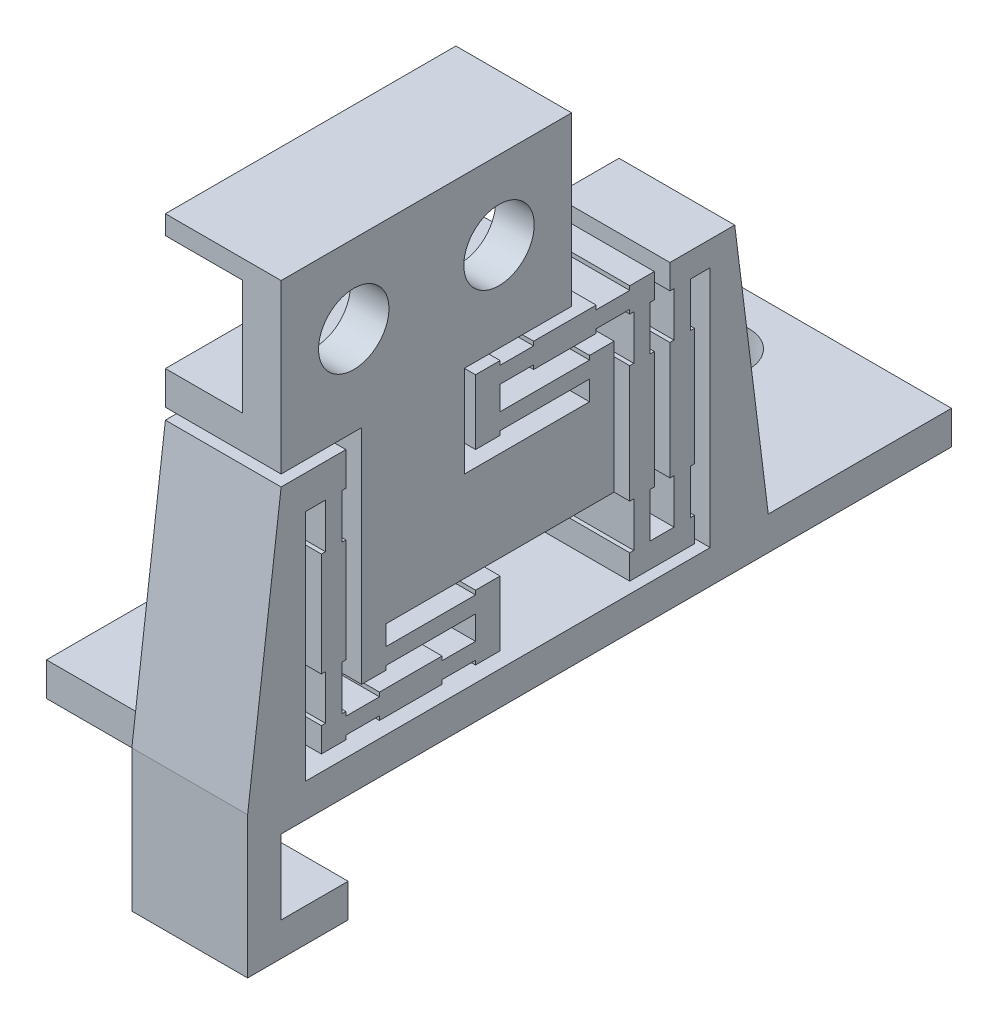
from build123d import *

# Parameters (mm, degrees)
BOSS_EXTRUDE1_DEPTH = 5.18
CUT_EXTRUDE1_REACH  = 36.536
SKETCH2_W           = 3.45
SKETCH2_H           = 5.15
SKETCH3_W           = 10.5
SKETCH3_H           = 30
SKETCH3_R           = 1.575
BOSS_EXTRUDE2_DEPTH = 1.5
CUT_EXTRUDE3_REACH  = 43.242
SKETCH7_R           = 1.575


with BuildPart() as part:
    # Sketch1 → Boss-Extrude1 (new body)
    with BuildSketch(Plane(origin=(0, 0, 0), x_dir=(0, 0, -1), z_dir=(1, 0, 0))):
        Polygon((0, 0), (13, 0), (13, -7.5), (8.2, -7.5), (8.2, -11.6), (13.8, -11.6), (13.8, -10.716666667), (9.8, -10.716666667), (9.8, -10.9), (8.7, -10.9), (8.7, -8), (9.8, -8), (9.8, -8.183333333), (11.3, -8.183333333), (11.3, -8), (14.1, -8), (14.1, -8.183333333), (15.6, -8.183333333), (15.6, -8), (16.7, -8), (16.7, -9.1), (16.516666667, -9.1), (16.516666667, -11.1), (16.7, -11.1), (16.7, -16.35), (16.516666667, -16.35), (16.516666667, -18.35), (17.583333333, -18.35), (17.583333333, -16.35), (17.4, -16.35), (17.4, -11.1), (17.583333333, -11.1), (17.583333333, -9.1), (17.4, -9.1), (17.4, -8), (20.3, -8), (21.8, -19.95), (21.8, -21.45), (0, -21.45), (0, -24.78), (3, -24.78), (3, -26.28), (-1.5, -26.28), (-1.5, -19.95), (0, -8), (2.9, -8), (2.9, -9.5), (2.716666667, -9.5), (2.716666667, -11.5), (2.9, -11.5), (2.9, -16.15), (2.716666667, -16.15), (2.716666667, -18.15), (2.9, -18.15), (2.9, -18.333333333), (4.4, -18.333333333), (4.4, -18.15), (7.2, -18.15), (7.2, -18.333333333), (8.7, -18.333333333), (8.7, -17.266666667), (4.7, -17.266666667), (4.7, -17.45), (3.6, -17.45), (3.6, -7.5), (0, -7.5), align=None)
        Polygon((14.9, -9.8), (14.9, -15.65), (4.7, -15.65), (4.7, -16.533333333), (8.7, -16.533333333), (8.7, -16.35), (9.8, -16.35), (9.8, -19.25), (8.7, -19.25), (8.7, -19.066666667), (7.2, -19.066666667), (7.2, -19.25), (4.4, -19.25), (4.4, -19.066666667), (2.9, -19.066666667), (2.9, -19.25), (1.8, -19.25), (1.8, -18.15), (1.983333333, -18.15), (1.983333333, -16.15), (1.8, -16.15), (1.8, -11.5), (1.983333333, -11.5), (1.983333333, -9.5), (1.1, -9.5), (1.1, -19.95), (19.2, -19.95), (19.2, -9.1), (18.316666667, -9.1), (18.316666667, -11.1), (18.5, -11.1), (18.5, -16.35), (18.316666667, -16.35), (18.316666667, -18.35), (18.5, -18.35), (18.5, -19.45), (15.6, -19.45), (15.6, -18.35), (15.783333333, -18.35), (15.783333333, -16.35), (15.6, -16.35), (15.6, -11.1), (15.783333333, -11.1), (15.783333333, -9.1), (15.6, -9.1), (15.6, -8.916666667), (14.1, -8.916666667), (14.1, -9.1), (11.3, -9.1), (11.3, -8.916666667), (9.8, -8.916666667), (9.8, -9.983333333), (13.8, -9.983333333), (13.8, -9.8), align=None, mode=Mode.SUBTRACT)
    extrude(amount=BOSS_EXTRUDE1_DEPTH)

    # Sketch2 → Cut-Extrude1 (cut, up to next)
    with BuildSketch(Plane.XY, mode=Mode.PRIVATE) as cut_extrude1_sk1:
        with Locations((3.455, -3.425)):
            Rectangle(SKETCH2_W, SKETCH2_H)
    cut_extrude1_tool1 = extrude(cut_extrude1_sk1.sketch, amount=-CUT_EXTRUDE1_REACH, mode=Mode.PRIVATE) & part.part
    add(cut_extrude1_tool1.solids().sort_by_distance((3.455, -3.425, 0))[0], mode=Mode.SUBTRACT)

    # Sketch3 → Boss-Extrude2 (add)
    with BuildSketch(Plane.XZ.offset(21.45)):
        with Locations((5.25, -15)):
            Rectangle(SKETCH3_W, SKETCH3_H)
        with Locations(Location((7.62, -14.98, 0), (0, 0, 270))):
            Circle(SKETCH3_R, mode=Mode.SUBTRACT)
        with Locations(Location((7.62, -26.98, 0), (0, 0, 270))):
            Circle(SKETCH3_R, mode=Mode.SUBTRACT)
    extrude(amount=-BOSS_EXTRUDE2_DEPTH)

    # Sketch7 → Cut-Extrude3 (cut, up to next)
    with BuildSketch(Plane.ZY, mode=Mode.PRIVATE) as cut_extrude3_sk1:
        with Locations((-3.25, -3.5)):
            Circle(SKETCH7_R)
    cut_extrude3_tool1 = extrude(cut_extrude3_sk1.sketch, amount=-CUT_EXTRUDE3_REACH, mode=Mode.PRIVATE) & part.part
    # Sketch7 → Cut-Extrude3 (cut, up to next)
    with BuildSketch(Plane.ZY, mode=Mode.PRIVATE) as cut_extrude3_sk2:
        with Locations((-9.75, -3.5)):
            Circle(SKETCH7_R)
    cut_extrude3_tool2 = extrude(cut_extrude3_sk2.sketch, amount=-CUT_EXTRUDE3_REACH, mode=Mode.PRIVATE) & part.part
    add(cut_extrude3_tool1.solids().sort_by_distance((0, -3.5, -3.25))[0], mode=Mode.SUBTRACT)
    add(cut_extrude3_tool2.solids().sort_by_distance((0, -3.5, -9.75))[0], mode=Mode.SUBTRACT)


with BuildPart() as body_2:
    # Mirror3: mirrored copy
    add(part.part.mirror(Plane(origin=(0, 0, 0), x_dir=(0, 0, 1), z_dir=(1, 0, 0))))


solid = body_2.part
